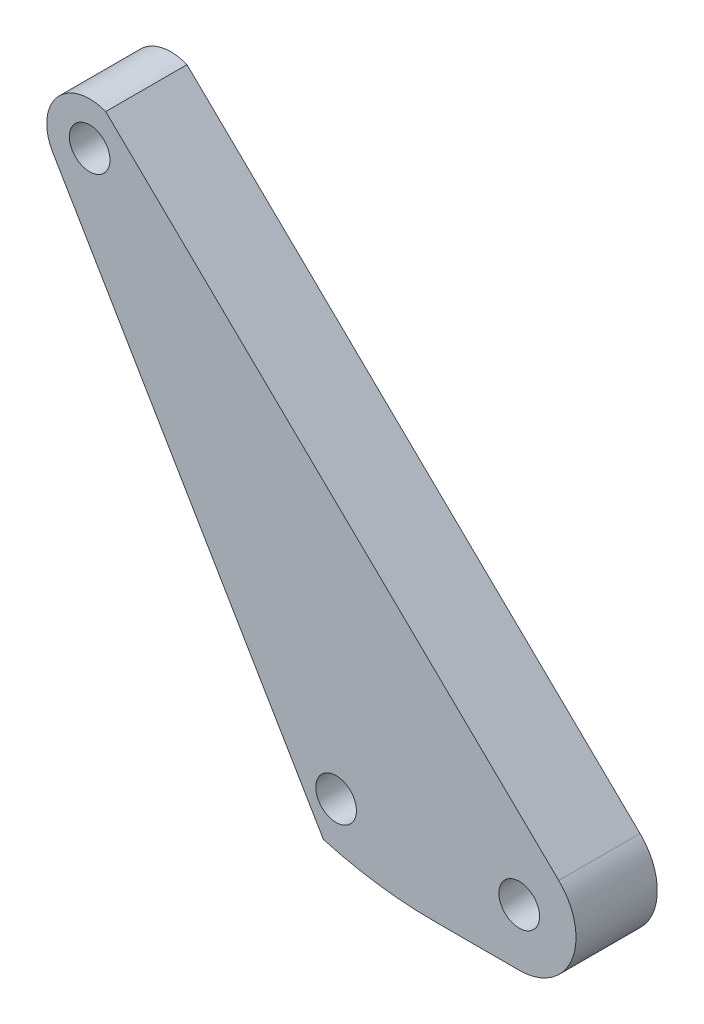
from build123d import *

# Parameters (mm, degrees)
SKETCH1_R           = 1
BOSS_EXTRUDE1_DEPTH = 4


with BuildPart() as part:
    # Sketch1 → Boss-Extrude1 (new body)
    with BuildSketch(Plane.XY):
        with BuildLine():
            Line((-17.977995316, 21.63664468), (4.314702222, 0.02018223))
            ThreePointArc((4.314702222, 0.02018223), (4.959291805, -3.035509426), (2.369361859, -4.780505155))
            Line((2.369361859, -4.780505155), (-1.814753039, -4.780505155))
            ThreePointArc((-1.814753039, -4.780505155), (-4.566347453, -4.590095833), (-7.265488027, -4.022497651))
            Line((-7.265488027, -4.022497651), (-20.58664465, 18.604327308))
            ThreePointArc((-20.58664465, 18.604327308), (-20.367613976, 21.054145339), (-17.977995316, 21.63664468))
        make_face()
        with Locations((2.369361859, -1.986014872)):
            Circle(SKETCH1_R, mode=Mode.SUBTRACT)
        with Locations((-18.765928056, 19.676243096)):
            Circle(SKETCH1_R, mode=Mode.SUBTRACT)
        with Locations((-6.640947392, -1.986014872)):
            Circle(SKETCH1_R, mode=Mode.SUBTRACT)
    extrude(amount=BOSS_EXTRUDE1_DEPTH)


solid = part.part
